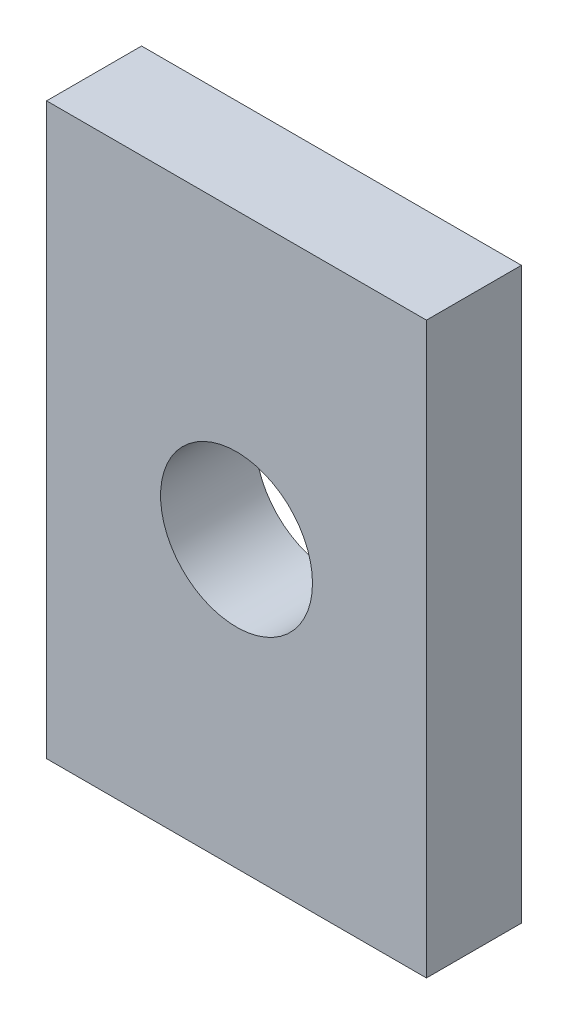
from build123d import *

# Parameters (mm, degrees)
SKETCH1_W           = 20
SKETCH1_H           = 30
BOSS_EXTRUDE1_DEPTH = 5
SKETCH2_R           = 4
CUT_EXTRUDE1_DEPTH  = 10


with BuildPart() as part:
    # Sketch1 → Boss-Extrude1 (new body)
    with BuildSketch(Plane.XY):
        Rectangle(SKETCH1_W, SKETCH1_H)
    extrude(amount=BOSS_EXTRUDE1_DEPTH)

    # Sketch2 → Cut-Extrude1 (cut)
    with BuildSketch(Plane.XY.offset(5)):
        Circle(SKETCH2_R)
    extrude(amount=-CUT_EXTRUDE1_DEPTH, mode=Mode.SUBTRACT)


solid = part.part
